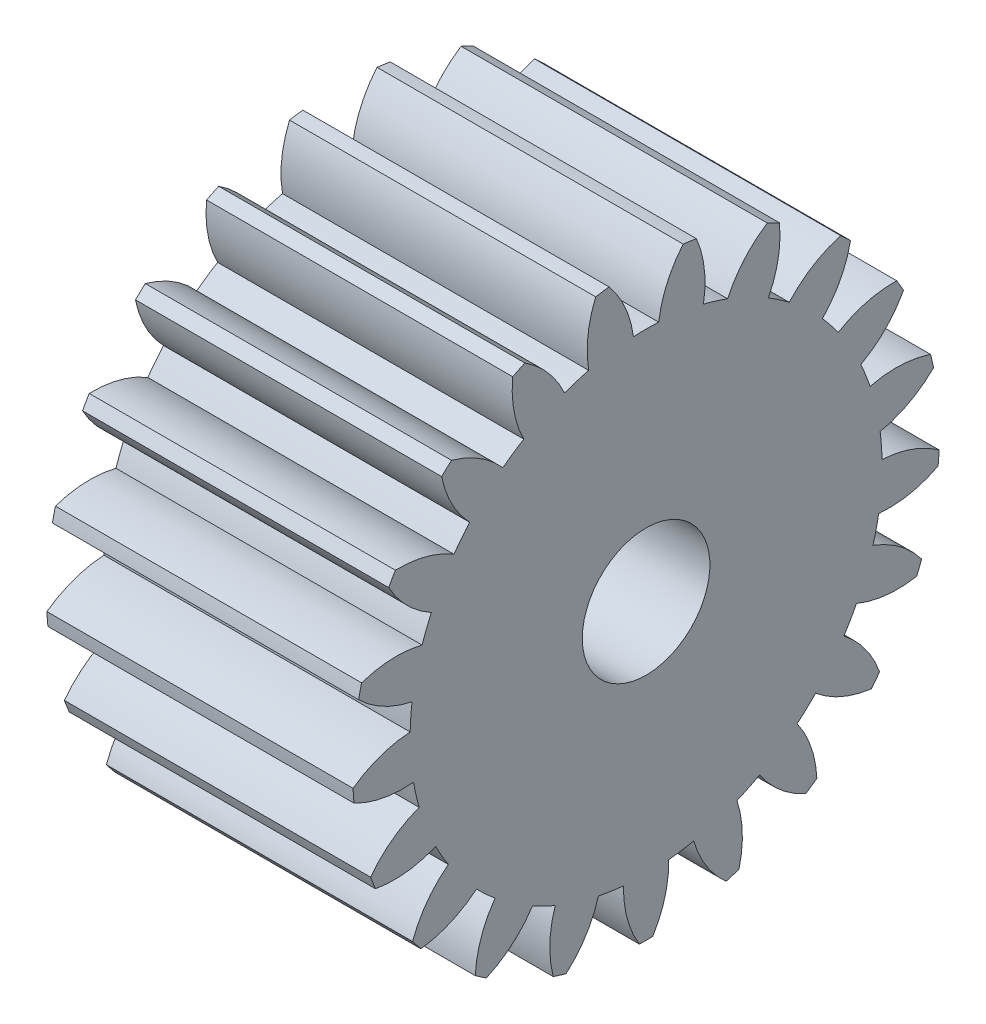
from build123d import *

# Parameters (mm, degrees)
BASPROSKE_W     = 12
BASPROSKE_H     = 11.5
TOOTHCUT_DEPTH  = 21.211382931
TEETHCUTS_COUNT = 21
TEETHCUTS_ANGLE = 342.857142857
BORSKE_R        = 2.5
BORE_DEPTH      = 50.0000508


with BuildPart() as part:
    # BasProSke → Base-Revolve (revolve)
    with BuildSketch(Plane(origin=(0, 0, 0), x_dir=(1, 0, 0), z_dir=(0, 1, 0)), mode=Mode.PRIVATE) as base_revolve_sk:
        with Locations((6, 5.75)):
            Rectangle(BASPROSKE_W, BASPROSKE_H)
    revolve(base_revolve_sk.sketch.rotate(Axis((-10, 0, 0), (1, 0, 0)), 180), axis=Axis((-10, 0, 0), (1, 0, 0)))

    # TooCutSke → ToothCut (cut, through all)
    with BuildSketch(Plane(origin=(0, 0, 0), x_dir=(0, 0, -1), z_dir=(1, 0, 0))):
        with BuildLine():
            ThreePointArc((0.49526894, 9.235730057), (0, 9.249), (-0.49526894, 9.235730057))
            ThreePointArc((-0.49526894, 9.235730057), (-0.823521057, 10.404716786), (-1.472455249, 11.430954496))
            ThreePointArc((-1.472455249, 11.430954496), (0, 11.5254), (1.472455249, 11.430954496))
            ThreePointArc((1.472455249, 11.430954496), (0.823521057, 10.404716786), (0.49526894, 9.235730057))
        make_face()
    toothcut = extrude(amount=TOOTHCUT_DEPTH, mode=Mode.SUBTRACT)

    # TeethCuts: ToothCut ×21 about axis
    teethcuts_axis = Axis((-10, 0, 0), (1, 0, 0))
    for i in range(1, TEETHCUTS_COUNT):
        add(toothcut.rotate(teethcuts_axis, i * TEETHCUTS_ANGLE / (TEETHCUTS_COUNT - 1)), mode=Mode.SUBTRACT)

    # BorSke → Bore (cut, symmetric)
    with BuildSketch(Plane(origin=(0, 0, 0), x_dir=(0, 0, -1), z_dir=(1, 0, 0))):
        with Locations(Location((0, 0, 0), (0, 0, 180))):
            Circle(BORSKE_R)
    extrude(amount=BORE_DEPTH, both=True, mode=Mode.SUBTRACT)


solid = part.part
